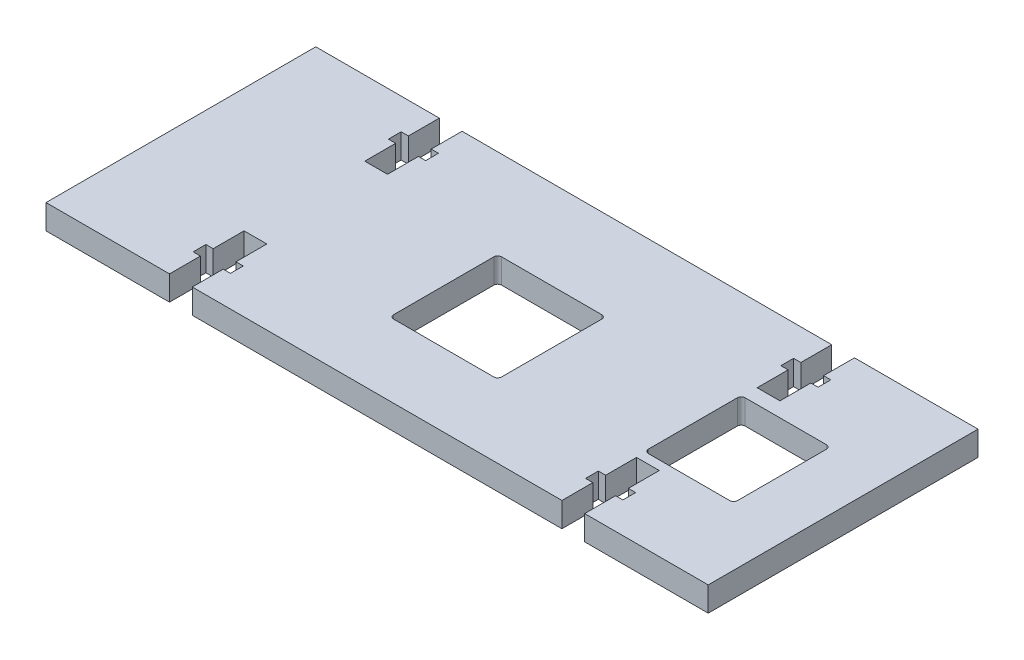
from build123d import *

# Parameters (mm, degrees)
SKETCH1_W           = 85.725
SKETCH1_H           = 34.925
BOSS_EXTRUDE1_DEPTH = 3.175
SKETCH2_W           = 13.97
SKETCH2_H           = 13.97
SKETCH2_W_2         = 11.54
SKETCH2_H_2         = 12.524
CUT_EXTRUDE1_DEPTH  = 47.391954448
FILLET1_R           = 0.508
CUT_EXTRUDE2_DEPTH  = 47.391954448


with BuildPart() as part:
    # Sketch1 → Boss-Extrude1 (new body)
    with BuildSketch(Plane(origin=(0, 0, 0), x_dir=(1, 0, 0), z_dir=(0, 1, 0))):
        Rectangle(SKETCH1_W, SKETCH1_H)
    extrude(amount=BOSS_EXTRUDE1_DEPTH)

    # Sketch2 → Cut-Extrude1 (cut, through all)
    with BuildSketch(Plane(origin=(0, 0, 0), x_dir=(-1, 0, 0), z_dir=(0, -1, 0))):
        with Locations((0.8075, -1.0435)):
            Rectangle(SKETCH2_W, SKETCH2_H)
        with Locations((-29.5375, -0.3555)):
            Rectangle(SKETCH2_W_2, SKETCH2_H_2)
    extrude(amount=-CUT_EXTRUDE1_DEPTH, mode=Mode.SUBTRACT)

    # Fillet1
    fillet1_edges = [part.edges().sort_by_distance(p)[0] for p in [
        (6.1775, 1.5875, 8.0285),
        (6.1775, 1.5875, -5.9415),
        (-7.7925, 1.5875, -5.9415),
        (-7.7925, 1.5875, 8.0285),
        (23.7675, 1.5875, -5.9065),
        (23.7675, 1.5875, 6.6175),
        (35.3075, 1.5875, 6.6175),
        (35.3075, 1.5875, -5.9065),
    ]]
    fillet(fillet1_edges, radius=FILLET1_R)

    # Sketch3 → Cut-Extrude2 (cut, through all)
    with BuildSketch(Plane.XZ):
        Polygon((-26.8732, 17.4625), (-23.9268, 17.4625), (-23.9268, 13.462), (-22.987, 13.462), (-22.987, 11.811), (-23.9268, 11.811), (-23.9268, 7.8105), (-26.8732, 7.8105), (-26.8732, 11.811), (-27.813, 11.811), (-27.813, 13.462), (-26.8732, 13.462), align=None)
        Polygon((26.8732, 11.811), (26.8732, 7.8105), (23.9268, 7.8105), (23.9268, 11.811), (22.987, 11.811), (22.987, 13.462), (23.9268, 13.462), (23.9268, 17.4625), (26.8732, 17.4625), (26.8732, 13.462), (27.813, 13.462), (27.813, 11.811), align=None)
        Polygon((26.8732, -17.4625), (23.9268, -17.4625), (23.9268, -13.462), (22.987, -13.462), (22.987, -11.811), (23.9268, -11.811), (23.9268, -7.8105), (26.8732, -7.8105), (26.8732, -11.811), (27.813, -11.811), (27.813, -13.462), (26.8732, -13.462), align=None)
        Polygon((-26.8732, -11.811), (-26.8732, -7.8105), (-23.9268, -7.8105), (-23.9268, -11.811), (-22.987, -11.811), (-22.987, -13.462), (-23.9268, -13.462), (-23.9268, -17.4625), (-26.8732, -17.4625), (-26.8732, -13.462), (-27.813, -13.462), (-27.813, -11.811), align=None)
    extrude(amount=-CUT_EXTRUDE2_DEPTH, mode=Mode.SUBTRACT)


solid = part.part
